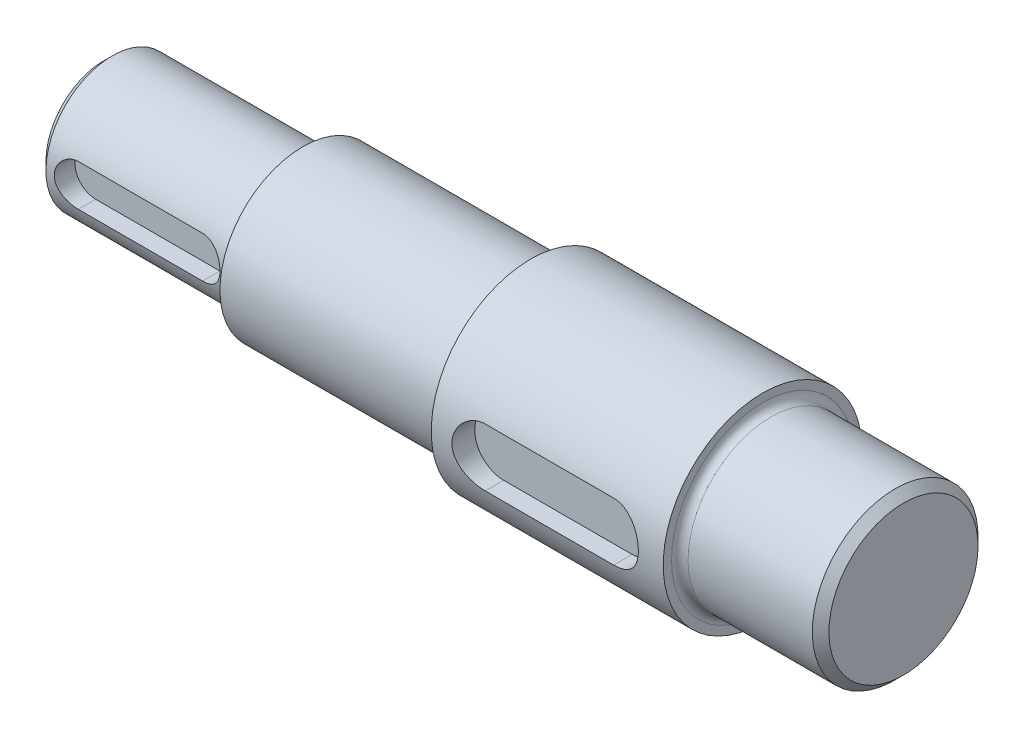
from build123d import *

# Parameters (mm, degrees)
CHAMFER_1_SIZE      = 2
FILLET_1_R          = 2
CUT_EXTRUDE_1_DEPTH = 5
CUT_EXTRUDE_2_DEPTH = 5.5


with BuildPart() as part:
    # Эскиз1 → Повернуть1 (revolve)
    with BuildSketch(Plane.XY):
        Polygon((0, 0), (0, 16), (48, 16), (48, 20), (103, 20), (103, 24), (159, 24), (159, 20), (193, 20), (193, 0), align=None)
    revolve(axis=Axis((193, 0, 0), (-1, 0, 0)))

    # Фаска1
    chamfer_1_edges = [part.edges().sort_by_distance(p)[0] for p in [
        (0, -16, 0),
        (193, -20, 0),
    ]]
    chamfer(chamfer_1_edges, length=CHAMFER_1_SIZE)

    # Скругление1
    fillet_1_edges = [part.edges().sort_by_distance(p)[0] for p in [
        (48, -16, 0),
        (159, -20, 0),
        (103, -20, 0),
    ]]
    fillet(fillet_1_edges, radius=FILLET_1_R)

    # Эскиз2 → Вырез-Вытянуть1 (cut)
    with BuildSketch(Plane.XY.offset(16)):
        with BuildLine():
            Line((9, 5), (39, 5))
            ThreePointArc((39, 5), (44, 0), (39, -5))
            Line((39, -5), (9, -5))
            ThreePointArc((9, -5), (4, 0), (9, 5))
        make_face()
    extrude(amount=-CUT_EXTRUDE_1_DEPTH, mode=Mode.SUBTRACT)

    # Эскиз3 → Вырез-Вытянуть2 (cut)
    with BuildSketch(Plane.XY.offset(24)):
        with BuildLine():
            Line((115, 7), (146, 7))
            ThreePointArc((146, 7), (153, 0), (146, -7))
            Line((146, -7), (115, -7))
            ThreePointArc((115, -7), (108, 0), (115, 7))
        make_face()
    extrude(amount=-CUT_EXTRUDE_2_DEPTH, mode=Mode.SUBTRACT)


solid = part.part
